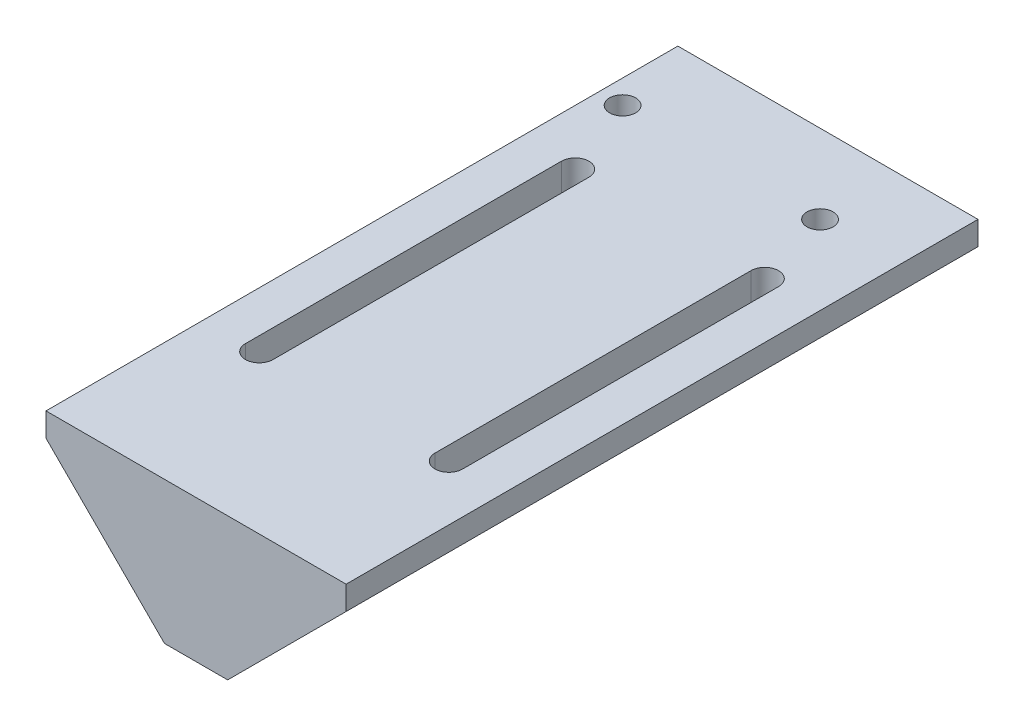
from build123d import *

# Parameters (mm, degrees)
BOSS_EXTRUDE1_DEPTH   = 80
CUT_EXTRUDE1_DEPTH    = 40
M4X0_7_TAPPED_HOLE1_D = 3.3


with BuildPart() as part:
    # Sketch1 → Boss-Extrude1 (new body)
    with BuildSketch(Plane.XY):
        Polygon((-4, 0), (4, 0), (19, 15), (19, 18), (-19, 18), (-19, 15), align=None)
    extrude(amount=BOSS_EXTRUDE1_DEPTH)

    # Sketch2 → Cut-Extrude1 (cut)
    with BuildSketch(Plane(origin=(0, 18, 0), x_dir=(1, 0, 0), z_dir=(0, 1, 0))):
        with BuildLine():
            Line((-10.25, -20), (-10.25, -60))
            ThreePointArc((-10.25, -60), (-12, -61.75), (-13.75, -60))
            Line((-13.75, -60), (-13.75, -20))
            ThreePointArc((-13.75, -20), (-12, -18.25), (-10.25, -20))
        make_face()
        with BuildLine():
            Line((13.75, -20), (13.75, -60))
            ThreePointArc((13.75, -60), (12, -61.75), (10.25, -60))
            Line((10.25, -60), (10.25, -20))
            ThreePointArc((10.25, -20), (12, -18.25), (13.75, -20))
        make_face()
    extrude(amount=-CUT_EXTRUDE1_DEPTH, mode=Mode.SUBTRACT)

    # M4x0.7 Tapped Hole1 (through all)
    with Locations(Plane(origin=(0, 18, 0), x_dir=(1, 0, 0), z_dir=(0, 1, 0))):
        with Locations((9.00246861, -10), (-15.99753139, -10)):
            Hole(M4X0_7_TAPPED_HOLE1_D / 2)


solid = part.part
